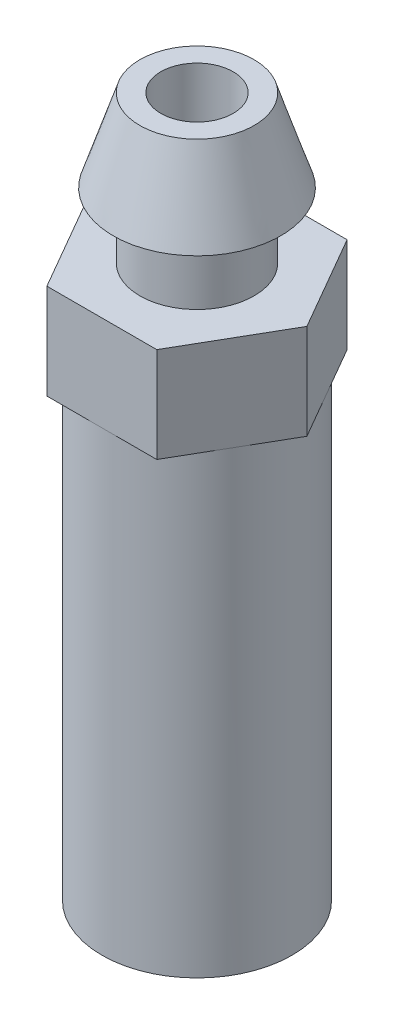
from build123d import *

# Parameters (mm, degrees)
SKETCH1_R           = 3.175
BOSS_EXTRUDE1_DEPTH = 15.24
BOSS_EXTRUDE2_DEPTH = 3.175
SKETCH3_R           = 1.905
BOSS_EXTRUDE3_DEPTH = 2.032
SKETCH8_R           = 1.2065
CUT_EXTRUDE1_DEPTH  = 9.652


with BuildPart() as part:
    # Sketch1 → Boss-Extrude1 (new body)
    with BuildSketch(Plane(origin=(0, 0, 0), x_dir=(1, 0, 0), z_dir=(0, 1, 0))):
        with Locations(Location((0, 0, 0), (0, 0, 90))):
            Circle(SKETCH1_R)
    extrude(amount=BOSS_EXTRUDE1_DEPTH)

    # Sketch2 → Boss-Extrude2 (add)
    with BuildSketch(Plane(origin=(0, 15.24, 0), x_dir=(1, 0, 0), z_dir=(0, 1, 0))):
        Polygon((3.666174209, 0), (1.833087105, 3.175), (-1.833087105, 3.175), (-3.666174209, 0), (-1.833087105, -3.175), (1.833087105, -3.175), align=None)
    extrude(amount=BOSS_EXTRUDE2_DEPTH)

    # Sketch3 → Boss-Extrude3 (add)
    with BuildSketch(Plane(origin=(0, 18.415, 0), x_dir=(1, 0, 0), z_dir=(0, 1, 0))):
        with Locations(Location((0, 0, 0), (0, 0, 270))):
            Circle(SKETCH3_R)
    extrude(amount=BOSS_EXTRUDE3_DEPTH)


with BuildPart() as body_2:
    # Sketch7 → Revolve1 (revolve)
    with BuildSketch(Plane.XY, mode=Mode.PRIVATE) as revolve1_sk:
        Polygon((0, 20.594712364), (2.794, 20.594712364), (1.905, 23.337912364), (0, 23.337912364), align=None)
    revolve(revolve1_sk.sketch.rotate(Axis((0, 23.337912364, 0), (0, -1, 0)), 180), axis=Axis((0, 23.337912364, 0), (0, -1, 0)))


with BuildPart() as cut_extrude1_tool:
    # Sketch8 → Cut-Extrude1 (new body)
    with BuildSketch(Plane(origin=(0, 23.337912364, 0), x_dir=(1, 0, 0), z_dir=(0, 1, 0))):
        with Locations(Location((0, 0, 0), (0, 0, 180))):
            Circle(SKETCH8_R)
    extrude(amount=-CUT_EXTRUDE1_DEPTH)


with BuildPart() as part_1:
    add(part.part)

    # Cut-Extrude1: cut by cut_extrude1_tool
    add(cut_extrude1_tool.part, mode=Mode.SUBTRACT)


with BuildPart() as body_2_1:
    add(body_2.part)

    # Cut-Extrude1: cut by cut_extrude1_tool
    add(cut_extrude1_tool.part, mode=Mode.SUBTRACT)


solid = Compound([part_1.part, body_2_1.part])
